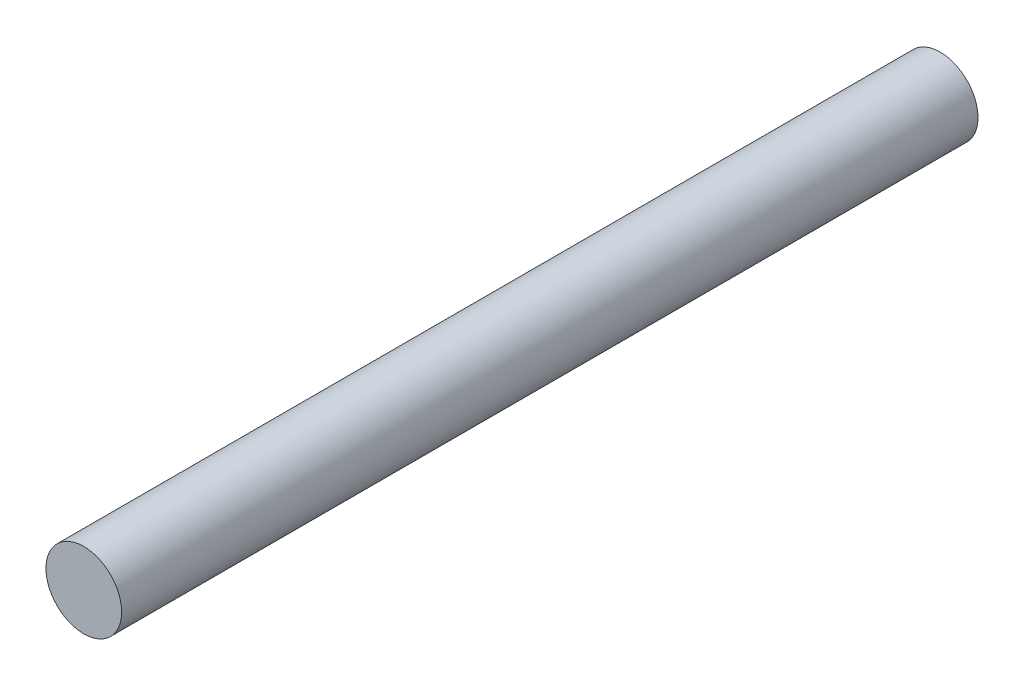
from build123d import *

# Parameters (mm, degrees)
SKETCH1_R           = 4.8625
BOSS_EXTRUDE1_DEPTH = 55


with BuildPart() as part:
    # Sketch1 → Boss-Extrude1 (new, symmetric)
    with BuildSketch(Plane.XY):
        Circle(SKETCH1_R)
    extrude(amount=BOSS_EXTRUDE1_DEPTH, both=True)


solid = part.part
